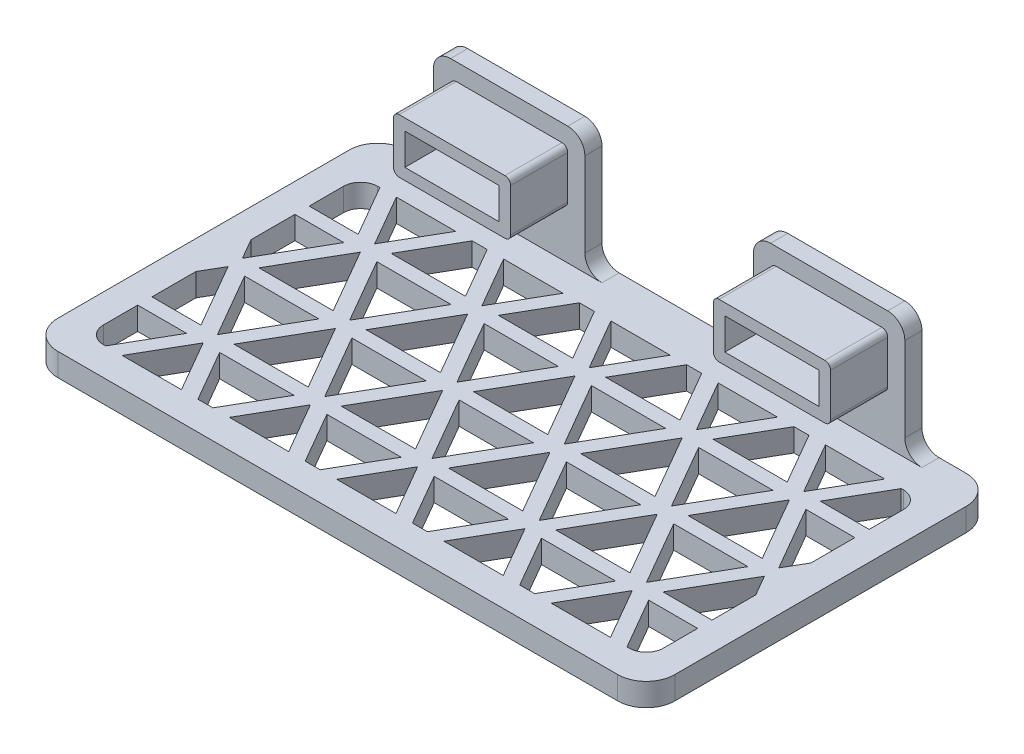
from build123d import *

# Parameters (mm, degrees)
SKETCH_1_W          = 108
SKETCH_1_H          = 58
EXTRUDE_1_DEPTH     = 4
SKETCH_2_W          = 16.5
SKETCH_2_H          = 5.5
EXTRUDE_2_DEPTH     = 3
SKETCH_2_3_W        = 16.5
SKETCH_2_3_H        = 5.5
SKETCH_2_3_W_2      = 108
SKETCH_2_3_H_2      = 4
EXTRUDE_3_DEPTH     = 10
FILLET_1_R          = 5
CUT_EXTRUDE_1_DEPTH = 4


with BuildPart() as part:
    # 草图1 → 凸台-拉伸1 (new body)
    with BuildSketch(Plane(origin=(0, 0, 0), x_dir=(1, 0, 0), z_dir=(0, 1, 0))):
        Rectangle(SKETCH_1_W, SKETCH_1_H)
    extrude(amount=EXTRUDE_1_DEPTH)

    # 草图2 → 凸台-拉伸2 (add)
    with BuildSketch(Plane(origin=(0, 0, -29), x_dir=(-1, 0, 0), z_dir=(0, 0, -1))):
        with BuildLine():
            ThreePointArc((-38.25, 24.75), (-40.371320344, 23.871320344), (-41.25, 21.75))
            Line((-41.25, 21.75), (-41.25, 7))
            ThreePointArc((-41.25, 7), (-42.128679656, 4.878679656), (-44.25, 4))
            Line((-44.25, 4), (-54, 4))
            Line((-54, 4), (-54, 0))
            Line((-54, 0), (54, 0))
            Line((54, 0), (54, 4))
            Line((54, 4), (44.25, 4))
            ThreePointArc((44.25, 4), (42.128679656, 4.878679656), (41.25, 7))
            Line((41.25, 7), (41.25, 21.75))
            ThreePointArc((41.25, 21.75), (40.371320344, 23.871320344), (38.25, 24.75))
            Line((38.25, 24.75), (17.75, 24.75))
            ThreePointArc((17.75, 24.75), (15.628679656, 23.871320344), (14.75, 21.75))
            Line((14.75, 21.75), (14.75, 7))
            ThreePointArc((14.75, 7), (13.871320344, 4.878679656), (11.75, 4))
            Line((11.75, 4), (-11.75, 4))
            ThreePointArc((-11.75, 4), (-13.871320344, 4.878679656), (-14.75, 7))
            Line((-14.75, 7), (-14.75, 21.75))
            ThreePointArc((-14.75, 21.75), (-15.628679656, 23.871320344), (-17.75, 24.75))
            Line((-17.75, 24.75), (-38.25, 24.75))
        make_face()
        with Locations((-28, 17)):
            Rectangle(SKETCH_2_W, SKETCH_2_H, mode=Mode.SUBTRACT)
        with Locations((28, 17)):
            Rectangle(SKETCH_2_W, SKETCH_2_H, mode=Mode.SUBTRACT)
    extrude(amount=EXTRUDE_2_DEPTH)

    # 草图2<3> → 凸台-拉伸3 (add)
    # profile 1 of 3: a face of its own
    with BuildSketch(Plane(origin=(0, 0, -29), x_dir=(-1, 0, 0), z_dir=(0, 0, -1))):
        with BuildLine():
            Line((-37.25, 21.75), (-18.75, 21.75))
            ThreePointArc((-18.75, 21.75), (-18.042893219, 21.457106781), (-17.75, 20.75))
            Line((-17.75, 20.75), (-17.75, 13.25))
            ThreePointArc((-17.75, 13.25), (-18.042893219, 12.542893219), (-18.75, 12.25))
            Line((-18.75, 12.25), (-37.25, 12.25))
            ThreePointArc((-37.25, 12.25), (-37.957106781, 12.542893219), (-38.25, 13.25))
            Line((-38.25, 13.25), (-38.25, 20.75))
            ThreePointArc((-38.25, 20.75), (-37.957106781, 21.457106781), (-37.25, 21.75))
        make_face()
        with Locations((-28, 17)):
            Rectangle(SKETCH_2_3_W, SKETCH_2_3_H, mode=Mode.SUBTRACT)
    # profile 2 of 3: a face of its own
    with BuildSketch(Plane(origin=(0, 0, -29), x_dir=(-1, 0, 0), z_dir=(0, 0, -1))):
        with BuildLine():
            Line((17.75, 20.75), (17.75, 13.25))
            ThreePointArc((17.75, 13.25), (18.042893219, 12.542893219), (18.75, 12.25))
            Line((18.75, 12.25), (37.25, 12.25))
            ThreePointArc((37.25, 12.25), (37.957106781, 12.542893219), (38.25, 13.25))
            Line((38.25, 13.25), (38.25, 20.75))
            ThreePointArc((38.25, 20.75), (37.957106781, 21.457106781), (37.25, 21.75))
            Line((37.25, 21.75), (18.75, 21.75))
            ThreePointArc((18.75, 21.75), (18.042893219, 21.457106781), (17.75, 20.75))
        make_face()
        with Locations((28, 17)):
            Rectangle(SKETCH_2_3_W, SKETCH_2_3_H, mode=Mode.SUBTRACT)
    # profile 3 of 3: a face of its own
    with BuildSketch(Plane(origin=(0, 0, -29), x_dir=(-1, 0, 0), z_dir=(0, 0, -1))):
        with Locations((0, 2)):
            Rectangle(SKETCH_2_3_W_2, SKETCH_2_3_H_2)
    extrude(amount=-EXTRUDE_3_DEPTH)

    # 圆角1
    fillet_1_edges = [part.edges().sort_by_distance(p)[0] for p in [
        (54, 2, -32),
        (-54, 2, -32),
        (54, 2, 29),
        (-54, 2, 29),
    ]]
    fillet(fillet_1_edges, radius=FILLET_1_R)

    # 草图3 → 切除-拉伸1 (cut)
    with BuildSketch(Plane.XZ):
        with BuildLine():
            Line((-49, 21), (-49, 15.008330249))
            Line((-49, 15.008330249), (-40.43375673, 15.008330249))
            Line((-40.43375673, 15.008330249), (-45.625099681, 24))
            Line((-45.625099681, 24), (-46, 24))
            ThreePointArc((-46, 24), (-48.121320344, 23.121320344), (-49, 21))
        make_face()
        Polygon((-32.355662433, 24), (-42.738348335, 24), (-37.547005384, 15.008330249), align=None)
        Polygon((-26.851596989, 24), (-29.468911087, 24), (-34.660254038, 15.008330249), (-21.660254038, 15.008330249), align=None)
        Polygon((-13.582159741, 24), (-23.964845643, 24), (-18.773502692, 15.008330249), align=None)
        Polygon((-8.078094297, 24), (-10.695408395, 24), (-15.886751346, 15.008330249), (-2.886751346, 15.008330249), align=None)
        Polygon((5.191342951, 24), (-5.191342951, 24), (0, 15.008330249), align=None)
        Polygon((10.695408395, 24), (8.078094297, 24), (2.886751346, 15.008330249), (15.886751346, 15.008330249), align=None)
        Polygon((23.964845643, 24), (13.582159741, 24), (18.773502692, 15.008330249), align=None)
        Polygon((29.468911087, 24), (26.851596989, 24), (21.660254038, 15.008330249), (34.660254038, 15.008330249), align=None)
        Polygon((42.738348335, 24), (32.355662433, 24), (37.547005384, 15.008330249), align=None)
        with BuildLine():
            Line((40.43375673, 15.008330249), (49, 15.008330249))
            Line((49, 15.008330249), (49, 21))
            ThreePointArc((49, 21), (48.121320344, 23.121320344), (46, 24))
            Line((46, 24), (45.625099681, 24))
            Line((45.625099681, 24), (40.43375673, 15.008330249))
        make_face()
        Polygon((46.93375673, 1.25), (49, 4.828838325), (49, 12.508330249), (40.43375673, 12.508330249), align=None)
        Polygon((44.047005384, 1.25), (31.047005384, 1.25), (37.547005384, 12.508330249), align=None)
        Polygon((21.660254038, 12.508330249), (28.160254038, 1.25), (34.660254038, 12.508330249), align=None)
        Polygon((25.273502692, 1.25), (12.273502692, 1.25), (18.773502692, 12.508330249), align=None)
        Polygon((2.886751346, 12.508330249), (15.886751346, 12.508330249), (9.386751346, 1.25), align=None)
        Polygon((6.5, 1.25), (-6.5, 1.25), (0, 12.508330249), align=None)
        Polygon((-2.886751346, 12.508330249), (-9.386751346, 1.25), (-15.886751346, 12.508330249), align=None)
        Polygon((-12.273502692, 1.25), (-25.273502692, 1.25), (-18.773502692, 12.508330249), align=None)
        Polygon((-21.660254038, 12.508330249), (-28.160254038, 1.25), (-34.660254038, 12.508330249), align=None)
        Polygon((-31.047005384, 1.25), (-44.047005384, 1.25), (-37.547005384, 12.508330249), align=None)
        Polygon((-49, 12.508330249), (-49, 4.828838325), (-46.93375673, 1.25), (-40.43375673, 12.508330249), align=None)
        Polygon((-49, -4.828838325), (-49, -12.508330249), (-40.43375673, -12.508330249), (-46.93375673, -1.25), align=None)
        Polygon((-37.547005384, -12.508330249), (-44.047005384, -1.25), (-31.047005384, -1.25), align=None)
        with BuildLine():
            ThreePointArc((-49, -21), (-48.121320344, -23.121320344), (-46, -24))
            Line((-46, -24), (-45.625099681, -24))
            Line((-45.625099681, -24), (-40.43375673, -15.008330249))
            Line((-40.43375673, -15.008330249), (-49, -15.008330249))
            Line((-49, -15.008330249), (-49, -21))
        make_face()
        Polygon((-37.547005384, -15.008330249), (-42.738348335, -24), (-32.355662433, -24), align=None)
        Polygon((-21.660254038, -12.508330249), (-28.160254038, -1.25), (-34.660254038, -12.508330249), align=None)
        Polygon((-34.660254038, -15.008330249), (-29.468911087, -24), (-26.851596989, -24), (-21.660254038, -15.008330249), align=None)
        Polygon((-18.773502692, -12.508330249), (-25.273502692, -1.25), (-12.273502692, -1.25), align=None)
        Polygon((-15.886751346, -15.008330249), (-10.695408395, -24), (-8.078094297, -24), (-2.886751346, -15.008330249), align=None)
        Polygon((-18.773502692, -15.008330249), (-23.964845643, -24), (-13.582159741, -24), align=None)
        Polygon((-2.886751346, -12.508330249), (-15.886751346, -12.508330249), (-9.386751346, -1.25), align=None)
        Polygon((0, -12.508330249), (-6.5, -1.25), (6.5, -1.25), align=None)
        Polygon((2.886751346, -15.008330249), (8.078094297, -24), (10.695408395, -24), (15.886751346, -15.008330249), align=None)
        Polygon((9.386751346, -1.25), (15.886751346, -12.508330249), (2.886751346, -12.508330249), align=None)
        Polygon((18.773502692, -12.508330249), (12.273502692, -1.25), (25.273502692, -1.25), align=None)
        Polygon((21.660254038, -15.008330249), (26.851596989, -24), (29.468911087, -24), (34.660254038, -15.008330249), align=None)
        Polygon((21.660254038, -12.508330249), (28.160254038, -1.25), (34.660254038, -12.508330249), align=None)
        Polygon((37.547005384, -12.508330249), (31.047005384, -1.25), (44.047005384, -1.25), align=None)
        Polygon((0, -15.008330249), (-5.191342951, -24), (5.191342951, -24), align=None)
        Polygon((18.773502692, -15.008330249), (13.582159741, -24), (23.964845643, -24), align=None)
        Polygon((37.547005384, -15.008330249), (32.355662433, -24), (42.738348335, -24), align=None)
        Polygon((40.43375673, -12.508330249), (49, -12.508330249), (49, -4.828838325), (46.93375673, -1.25), align=None)
        with BuildLine():
            Line((40.43375673, -15.008330249), (45.625099681, -24))
            Line((45.625099681, -24), (46, -24))
            ThreePointArc((46, -24), (48.121320344, -23.121320344), (49, -21))
            Line((49, -21), (49, -15.008330249))
            Line((49, -15.008330249), (40.43375673, -15.008330249))
        make_face()
    extrude(amount=-CUT_EXTRUDE_1_DEPTH, mode=Mode.SUBTRACT)


solid = part.part
